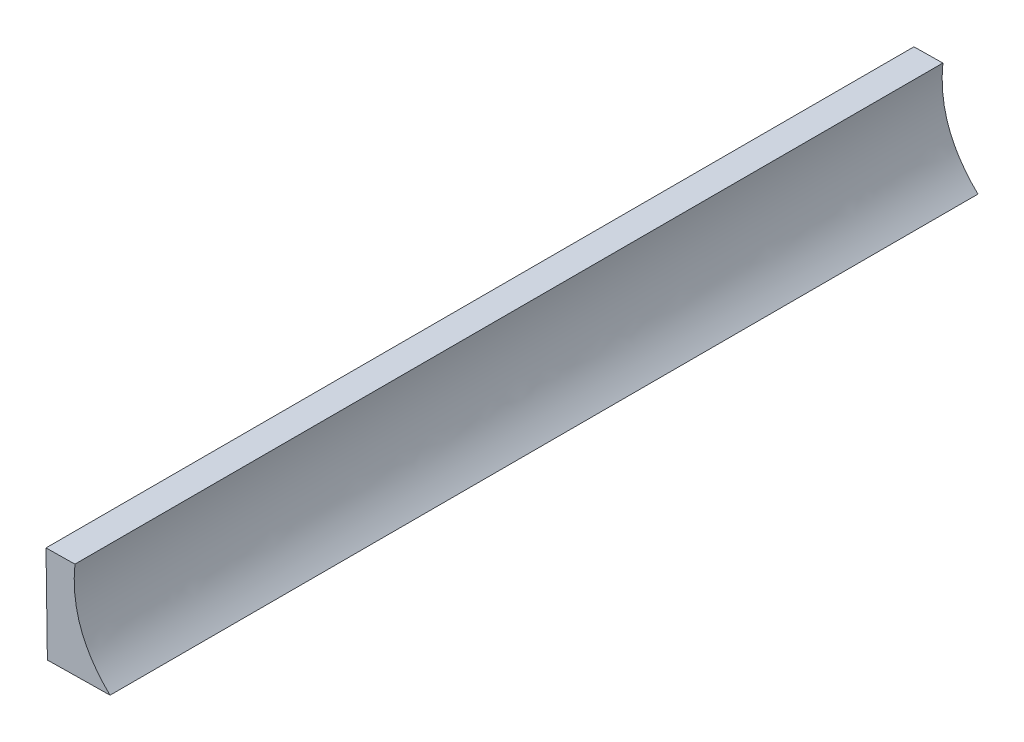
from build123d import *

# Parameters (mm, degrees)
BOSS_EXTRU_1_DEPTH = 180


with BuildPart() as part:
    # Esquisse1 → Boss.-Extru.1 (new body)
    with BuildSketch(Plane.XY):
        with BuildLine():
            Line((-55.498446445, 21.36815076), (-49.498446445, 21.454135734))
            add(Edge.make_bspline(
                [(-49.498446445, 21.454135734), (-50.710292973, 9.615331402), (-42.211859293, 1.556504946)],
                knots=[0, 0, 0, 1, 1, 1], degree=2))
            Line((-42.211859293, 1.556504946), (-55.211859293, 1.37020417))
            Line((-55.211859293, 1.37020417), (-55.498446445, 21.36815076))
        make_face()
    extrude(amount=BOSS_EXTRU_1_DEPTH)


solid = part.part
